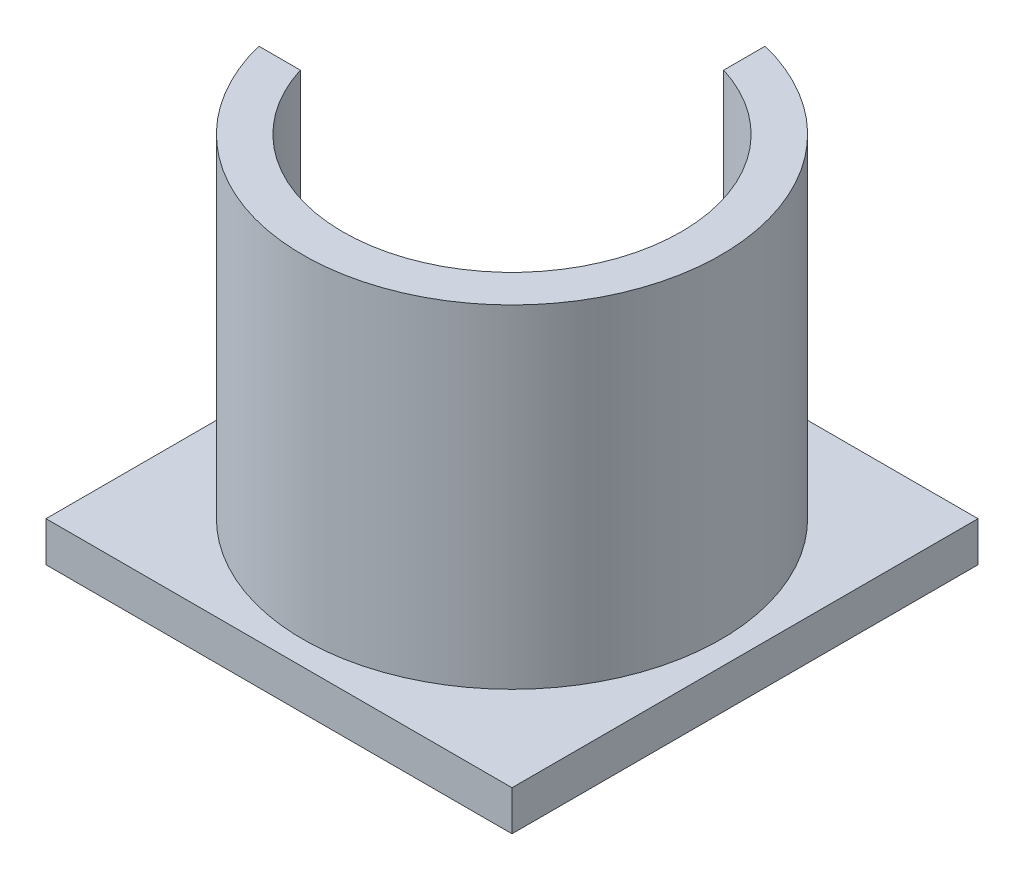
from build123d import *

# Parameters (mm, degrees)
SKETCH1_W           = 35
SKETCH1_H           = 35
BOSS_EXTRUDE1_DEPTH = 3
BOSS_EXTRUDE2_DEPTH = 25
CUT_EXTRUDE1_REACH  = 37.178


with BuildPart() as part:
    # Sketch1 → Boss-Extrude1 (new body)
    with BuildSketch(Plane(origin=(0, 0, 0), x_dir=(1, 0, 0), z_dir=(0, 1, 0))):
        Rectangle(SKETCH1_W, SKETCH1_H)
    extrude(amount=BOSS_EXTRUDE1_DEPTH)

    # Sketch2 → Boss-Extrude2 (add)
    with BuildSketch(Plane(origin=(0, 3, 0), x_dir=(1, 0, 0), z_dir=(0, 1, 0))):
        with BuildLine():
            Line((3.77290479, 12.126631414), (3.77290479, 15.239920913))
            ThreePointArc((3.77290479, 15.239920913), (11.101576465, -11.101576465), (-15.239920913, -3.77290479))
            Line((-15.239920913, -3.77290479), (-12.126631414, -3.77290479))
            ThreePointArc((-12.126631414, -3.77290479), (8.980256121, -8.980256121), (3.77290479, 12.126631414))
        make_face()
    extrude(amount=BOSS_EXTRUDE2_DEPTH)

    # Sketch3 → Cut-Extrude1 (cut, up to next)
    with BuildSketch(Plane(origin=(0, 3, 0), x_dir=(1, 0, 0), z_dir=(0, 1, 0)), mode=Mode.PRIVATE) as cut_extrude1_sk1:
        with BuildLine():
            Line((2.757716447, 2.757716447), (-11.984567107, 17.5))
            Line((-11.984567107, 17.5), (-17.5, 17.5))
            Line((-17.5, 17.5), (-17.5, 11.984567107))
            Line((-17.5, 11.984567107), (-2.757716447, -2.757716447))
            ThreePointArc((-2.757716447, -2.757716447), (2.757716447, -2.757716447), (2.757716447, 2.757716447))
        make_face()
    cut_extrude1_tool1 = extrude(cut_extrude1_sk1.sketch, amount=-CUT_EXTRUDE1_REACH, mode=Mode.PRIVATE) & part.part
    add(cut_extrude1_tool1.solids().sort_by_distance((-6.984587, 3, -6.984587))[0], mode=Mode.SUBTRACT)


solid = part.part
